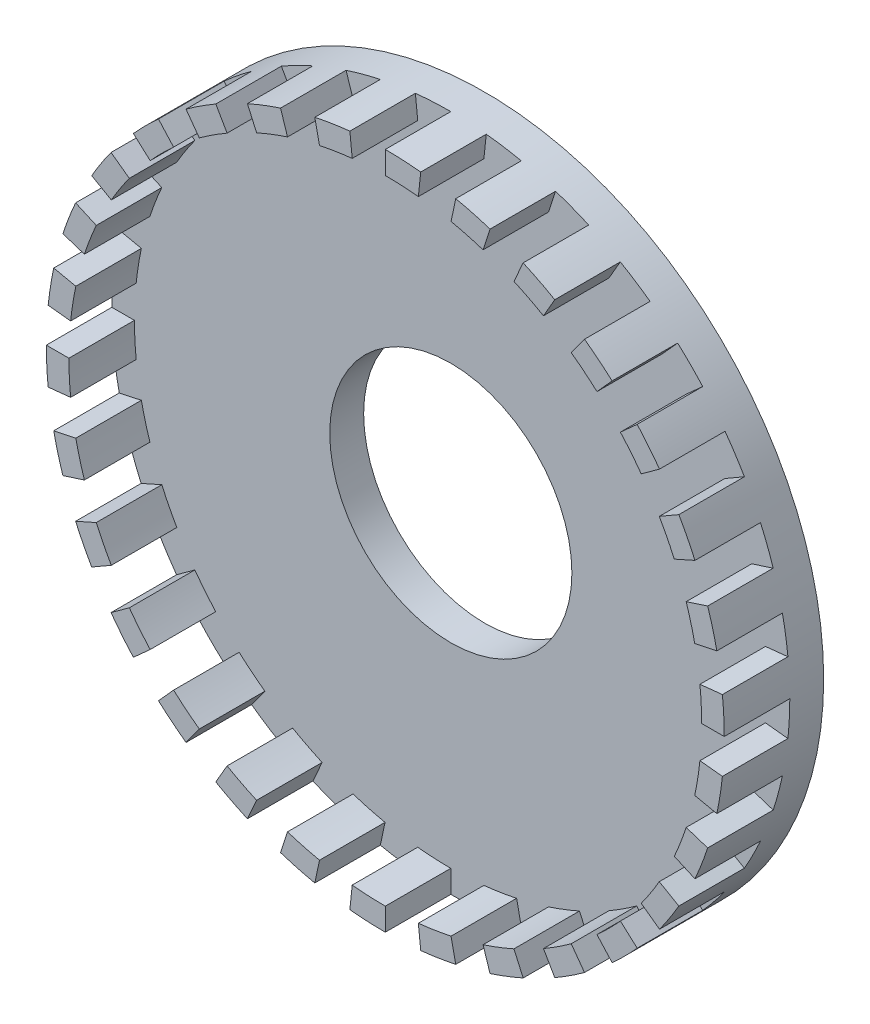
from build123d import *

# Parameters (mm, degrees)
SKETCH1_R           = 30
SKETCH1_R_2         = 10.715625
BOSS_EXTRUDE1_DEPTH = 3
BOSS_EXTRUDE2_DEPTH = 5.8
CIRPATTERN1_COUNT   = 30


with BuildPart() as part:
    # Sketch1 → Boss-Extrude1 (new body)
    with BuildSketch(Plane.XY):
        Circle(SKETCH1_R)
        Circle(SKETCH1_R_2, mode=Mode.SUBTRACT)
    extrude(amount=BOSS_EXTRUDE1_DEPTH)

    # Sketch2 → Boss-Extrude2 (add)
    with BuildSketch(Plane.XY.offset(3)):
        with BuildLine():
            Line((0, 30), (0, 28))
            ThreePointArc((0, 28), (1.465406775, 27.961626973), (2.926796971, 27.84661307))
            Line((2.926796971, 27.84661307), (3.135853898, 29.835656861))
            ThreePointArc((3.135853898, 29.835656861), (1.570078687, 29.958886043), (0, 30))
        make_face()
    boss_extrude2 = extrude(amount=BOSS_EXTRUDE2_DEPTH)

    # CirPattern1: Boss-Extrude2 ×30 about axis
    cirpattern1_axis = Axis((0, 0, -106.639759077), (0, 0, 1))
    for i in range(1, CIRPATTERN1_COUNT):
        add(boss_extrude2.rotate(cirpattern1_axis, i * 360 / CIRPATTERN1_COUNT))


solid = part.part
